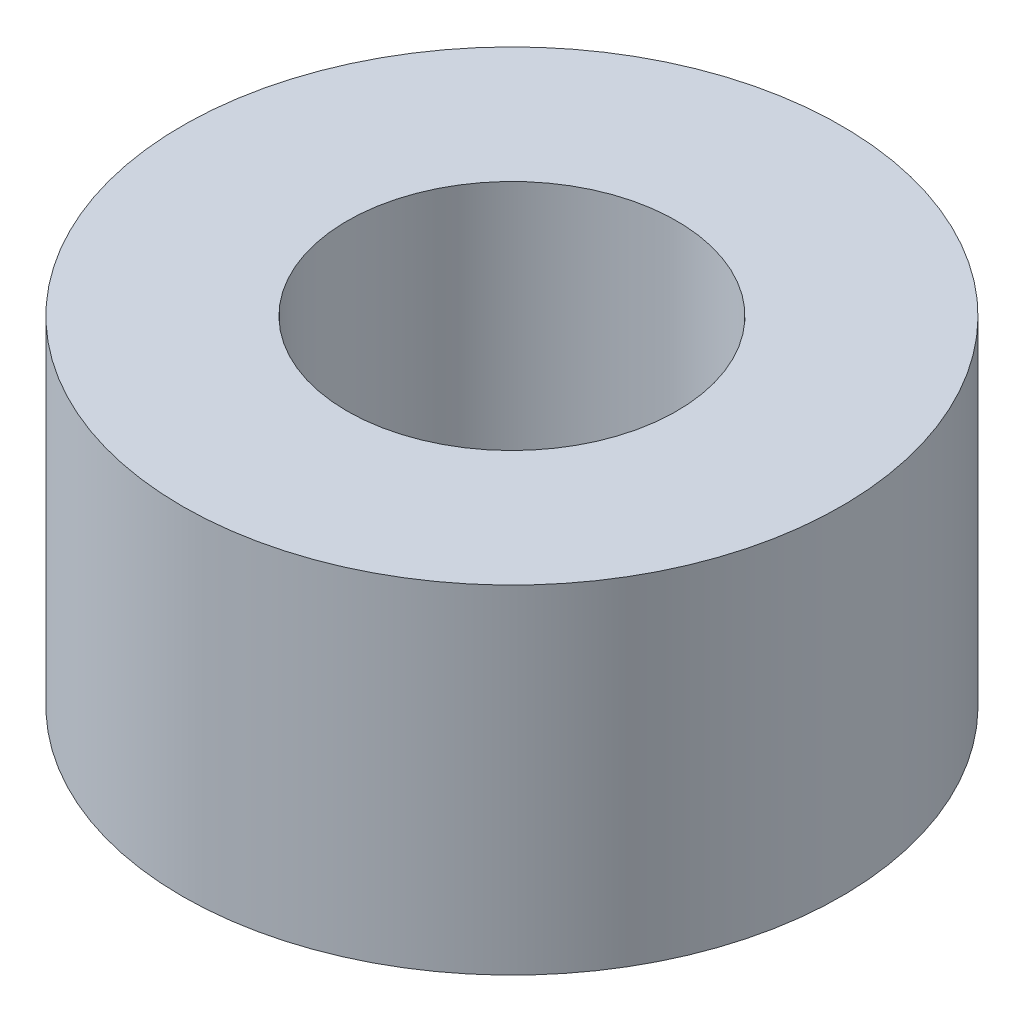
from build123d import *

# Parameters (mm, degrees)
SKIZZE1_R                       = 4
AUFSATZ_LINEAR_AUSTRAGEN1_DEPTH = 4.1
SKIZZE2_R                       = 2
SCHNITT_LINEAR_AUSTRAGEN1_DEPTH = 4.1


with BuildPart() as part:
    # Skizze1 → Aufsatz-Linear austragen1 (new body)
    with BuildSketch(Plane(origin=(0, 0, 0), x_dir=(1, 0, 0), z_dir=(0, 1, 0))):
        with Locations(Location((0, 0, 0), (0, 0, 270))):
            Circle(SKIZZE1_R)
    extrude(amount=-AUFSATZ_LINEAR_AUSTRAGEN1_DEPTH)

    # Skizze2 → Schnitt-Linear austragen1 (cut)
    with BuildSketch(Plane(origin=(0, 0, 0), x_dir=(1, 0, 0), z_dir=(0, 1, 0))):
        with Locations(Location((0, 0, 0), (0, 0, 270))):
            Circle(SKIZZE2_R)
    extrude(amount=-SCHNITT_LINEAR_AUSTRAGEN1_DEPTH, mode=Mode.SUBTRACT)


solid = part.part
